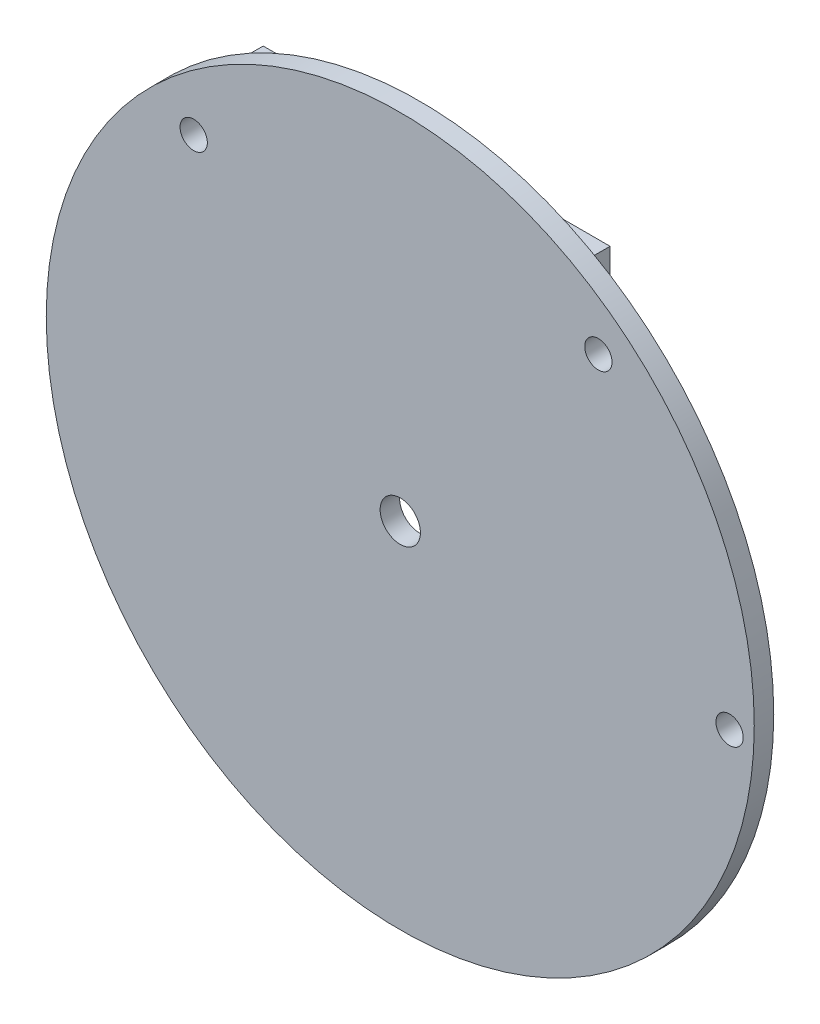
from build123d import *

# Parameters (mm, degrees)
SKETCH_1_R           = 27.25
SKETCH_1_R_2         = 1.05
SKETCH_1_R_3         = 1.55
EXTRUDE_1_DEPTH      = 1.5
SKETCH_2_W           = 26.7
SKETCH_2_H           = 19.2
EXTRUDE_2_DEPTH      = 1.3
BOSS_EXTRUDE1_DEPTH  = 1
CIRPATTERN1_COUNT    = 9
CIRPATTERN1_ANGLE    = 116
SKETCH2_W            = 2.46
SKETCH2_H            = 1.96
SKETCH2_W_2          = 1.96
SKETCH2_H_2          = 2.46
BOSS_EXTRUDE2_DEPTH  = 0.8
MIRROR1_COPY_1_DEPTH = 1
MIRROR1_COPY_2_DEPTH = 1
MIRROR1_COPY_3_DEPTH = 1
MIRROR1_COPY_4_DEPTH = 1
MIRROR1_COPY_5_DEPTH = 1
MIRROR1_COPY_6_DEPTH = 1
MIRROR1_COPY_7_DEPTH = 1
MIRROR1_COPY_8_DEPTH = 1


with BuildPart() as part:
    # Эскиз1 → Бобышка-Вытянуть1 (new body)
    with BuildSketch(Plane.XY):
        Circle(SKETCH_1_R)
        with Locations((-15.9, 17.8)):
            Circle(SKETCH_1_R_2, mode=Mode.SUBTRACT)
        with Locations((15.25, 18.75)):
            Circle(SKETCH_1_R_2, mode=Mode.SUBTRACT)
        with Locations((25.35, -1.23)):
            Circle(SKETCH_1_R_2, mode=Mode.SUBTRACT)
        Circle(SKETCH_1_R_3, mode=Mode.SUBTRACT)
    extrude(amount=EXTRUDE_1_DEPTH)

    # Эскиз2 → Бобышка-Вытянуть2 (add)
    with BuildSketch(Plane.XY):
        with Locations((0, 14)):
            Rectangle(SKETCH_2_W, SKETCH_2_H)
    extrude(amount=-EXTRUDE_2_DEPTH)

    # Sketch1 → Boss-Extrude1 (add)
    with BuildSketch(Plane(origin=(0, 0, 0), x_dir=(-1, 0, 0), z_dir=(0, 0, -1))):
        Polygon((19.047763091, 14.406246778), (20.703574047, 11.904589312), (16.367367772, 9.034516988), (14.711556816, 11.536174454), align=None)
    boss_extrude1 = extrude(amount=BOSS_EXTRUDE1_DEPTH)

    # CirPattern1: Boss-Extrude1 ×9 about axis
    cirpattern1_axis = Axis((0, 0, 0), (0, 0, 1))
    for i in range(1, CIRPATTERN1_COUNT):
        add(boss_extrude1.rotate(cirpattern1_axis, i * CIRPATTERN1_ANGLE / (CIRPATTERN1_COUNT - 1)))

    # Sketch2 → Boss-Extrude2 (add)
    with BuildSketch(Plane(origin=(0, 0, 0), x_dir=(-1, 0, 0), z_dir=(0, 0, -1))):
        with Locations((0, -3.38)):
            Rectangle(SKETCH2_W, SKETCH2_H)
        with Locations((-3.38, 0)):
            Rectangle(SKETCH2_W_2, SKETCH2_H_2)
        with Locations((3.38, 0)):
            Rectangle(SKETCH2_W_2, SKETCH2_H_2)
    extrude(amount=BOSS_EXTRUDE2_DEPTH)

    # Mirror1: Boss-Extrude1 across plane
    add(boss_extrude1.mirror(Plane(origin=(0, 0, 0), x_dir=(0, 0, 1), z_dir=(1, 0, 0))))

    # Mirror1 copy 1 sketch → Mirror1 copy 1 (add)
    with BuildSketch(Plane(origin=(0, 0, 0), x_dir=(0.9681476403781076, -0.25038000405444194, 0), z_dir=(0, 0, -1))):
        Polygon((19.047763091, -14.406246778), (20.703574047, -11.904589312), (16.367367772, -9.034516988), (14.711556816, -11.536174454), align=None)
    extrude(amount=MIRROR1_COPY_1_DEPTH)

    # Mirror1 copy 2 sketch → Mirror1 copy 2 (add)
    with BuildSketch(Plane(origin=(0, 0, 0), x_dir=(0.8746197071393953, -0.484809620246338, 0), z_dir=(0, 0, -1))):
        Polygon((19.047763091, -14.406246778), (20.703574047, -11.904589312), (16.367367772, -9.034516988), (14.711556816, -11.536174454), align=None)
    extrude(amount=MIRROR1_COPY_2_DEPTH)

    # Mirror1 copy 3 sketch → Mirror1 copy 3 (add)
    with BuildSketch(Plane(origin=(0, 0, 0), x_dir=(0.7253743710122864, -0.6883545756937552, 0), z_dir=(0, 0, -1))):
        Polygon((19.047763091, -14.406246778), (20.703574047, -11.904589312), (16.367367772, -9.034516988), (14.711556816, -11.536174454), align=None)
    extrude(amount=MIRROR1_COPY_3_DEPTH)

    # Mirror1 copy 4 sketch → Mirror1 copy 4 (add)
    with BuildSketch(Plane(origin=(0, 0, 0), x_dir=(0.529919264233203, -0.8480480961564272, 0), z_dir=(0, 0, -1))):
        Polygon((19.047763091, -14.406246778), (20.703574047, -11.904589312), (16.367367772, -9.034516988), (14.711556816, -11.536174454), align=None)
    extrude(amount=MIRROR1_COPY_4_DEPTH)

    # Mirror1 copy 5 sketch → Mirror1 copy 5 (add)
    with BuildSketch(Plane(origin=(0, 0, 0), x_dir=(0.3007057995042705, -0.9537169507482277, 0), z_dir=(0, 0, -1))):
        Polygon((19.047763091, -14.406246778), (20.703574047, -11.904589312), (16.367367772, -9.034516988), (14.711556816, -11.536174454), align=None)
    extrude(amount=MIRROR1_COPY_5_DEPTH)

    # Mirror1 copy 6 sketch → Mirror1 copy 6 (add)
    with BuildSketch(Plane(origin=(0, 0, 0), x_dir=(0.05233595624294042, -0.998629534754574, 0), z_dir=(0, 0, -1))):
        Polygon((19.047763091, -14.406246778), (20.703574047, -11.904589312), (16.367367772, -9.034516988), (14.711556816, -11.536174454), align=None)
    extrude(amount=MIRROR1_COPY_6_DEPTH)

    # Mirror1 copy 7 sketch → Mirror1 copy 7 (add)
    with BuildSketch(Plane(origin=(0, 0, 0), x_dir=(-0.199367934417201, -0.9799247046208288, 0), z_dir=(0, 0, -1))):
        Polygon((19.047763091, -14.406246778), (20.703574047, -11.904589312), (16.367367772, -9.034516988), (14.711556816, -11.536174454), align=None)
    extrude(amount=MIRROR1_COPY_7_DEPTH)

    # Mirror1 copy 8 sketch → Mirror1 copy 8 (add)
    with BuildSketch(Plane(origin=(0, 0, 0), x_dir=(-0.4383711467890815, -0.898794046299165, 0), z_dir=(0, 0, -1))):
        Polygon((19.047763091, -14.406246778), (20.703574047, -11.904589312), (16.367367772, -9.034516988), (14.711556816, -11.536174454), align=None)
    extrude(amount=MIRROR1_COPY_8_DEPTH)


solid = part.part
